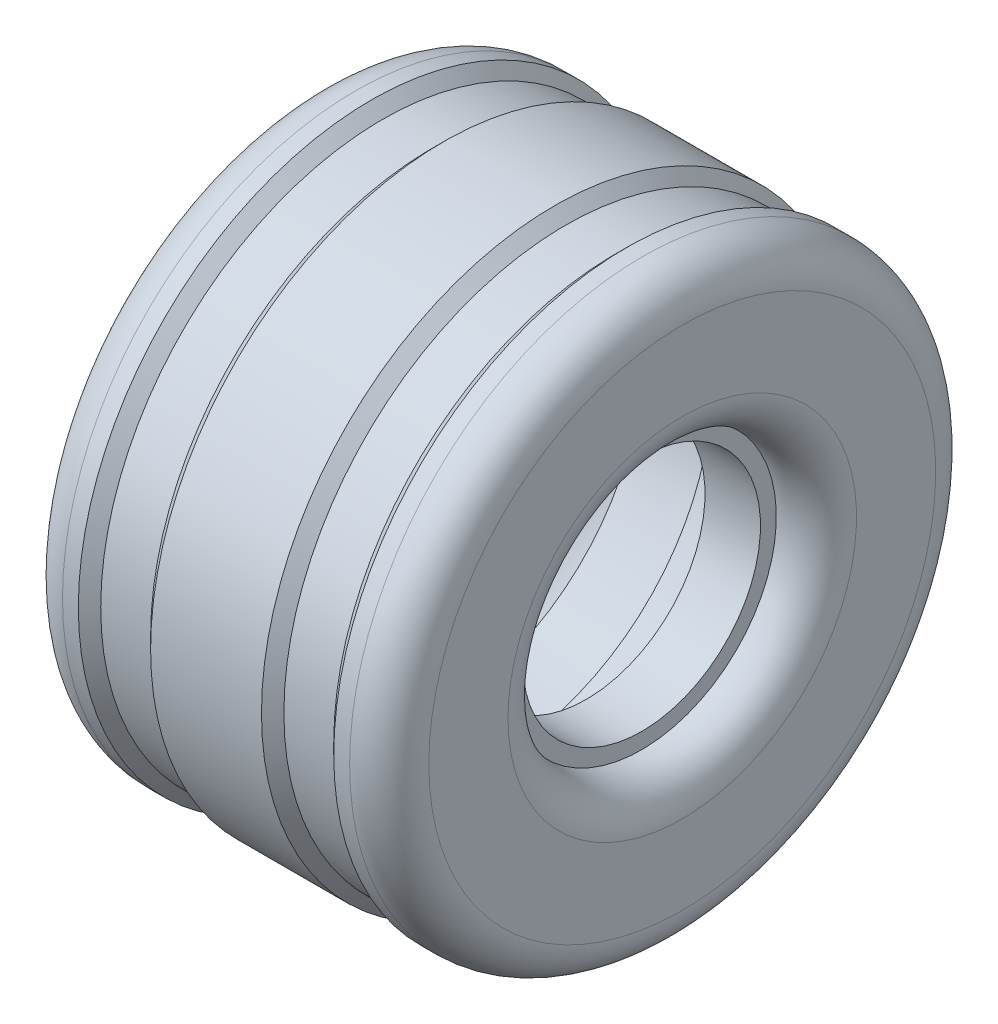
from build123d import *


with BuildPart() as part:
    # Esquisse1 → Révolution1 (revolve)
    with BuildSketch(Plane.XY, mode=Mode.PRIVATE) as r_volution1_sk:
        with BuildLine():
            Line((18.764169932, 369.984724907), (32.906305555, 355.842589283))
            Line((32.906305555, 355.842589283), (95.857864376, 355.842589283))
            Line((95.857864376, 355.842589283), (110, 369.984724907))
            Line((110, 369.984724907), (250, 369.984724907))
            Line((250, 369.984724907), (264.142135624, 355.842589283))
            Line((264.142135624, 355.842589283), (327.093694445, 355.842589283))
            Line((327.093694445, 355.842589283), (341.235830068, 369.984724907))
            Line((341.235830068, 369.984724907), (361.235830068, 369.984724907))
            ThreePointArc((361.235830068, 369.984724907), (396.591169128, 355.340063966), (411.235830068, 319.984724907))
            Line((411.235830068, 319.984724907), (411.235827615, 220.000387116))
            ThreePointArc((411.235827615, 220.000387116), (396.157108473, 184.20058995), (360, 170))
            Line((360, 170), (360, 150))
            Line((360, 150), (290, 150))
            Line((290, 150), (290, 170))
            Line((290, 170), (290, 220))
            add(Edge.make_bspline(
                [(290, 220), (295.244988156, 231.203943168), (256.566037823, 257.238059584)],
                knots=[0, 0, 0, 0.545738693, 0.545738693, 0.545738693], degree=2))
            Line((256.566037823, 257.238059584), (180, 268.278930242))
            Line((180, 268.278930242), (103.433962177, 257.238059584))
            add(Edge.make_bspline(
                [(70, 220), (64.755011844, 231.203943168), (103.433962177, 257.238059584)],
                knots=[0, 0, 0, 0.545738693, 0.545738693, 0.545738693], degree=2))
            Line((70, 220), (70, 170))
            Line((70, 170), (70, 150))
            Line((70, 150), (0, 150))
            Line((0, 150), (0, 170))
            ThreePointArc((0, 170), (-36.151503459, 184.195120946), (-51.235830068, 219.984724907))
            Line((-51.235830068, 219.984724907), (-51.235830068, 319.984724907))
            ThreePointArc((-51.235830068, 319.984724907), (-36.591169128, 355.340063966), (-1.235830068, 369.984724907))
            Line((-1.235830068, 369.984724907), (18.764169932, 369.984724907))
        make_face()
    revolve(r_volution1_sk.sketch.rotate(Axis((0, 0, 0), (1, 0, 0)), 90), axis=Axis((0, 0, 0), (1, 0, 0)))


solid = part.part
